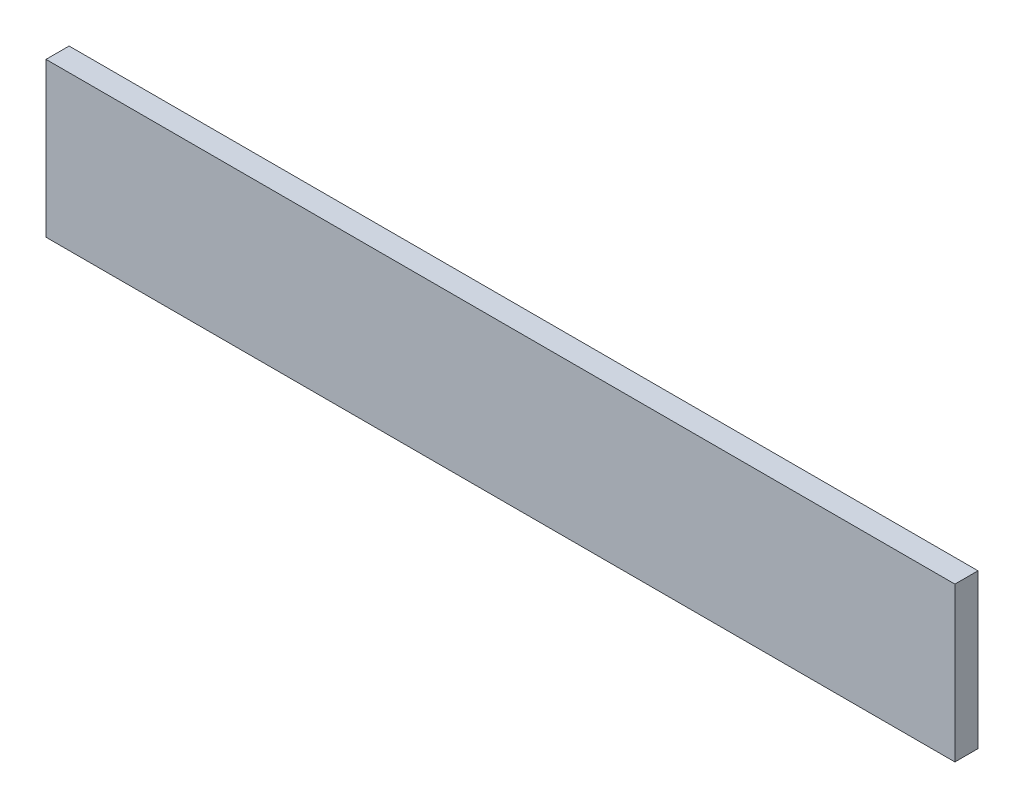
from build123d import *

# Parameters (mm, degrees)
SKETCH1_W           = 19.05
SKETCH1_H           = 127
BOSS_EXTRUDE1_DEPTH = 749.3


with BuildPart() as part:
    # Sketch1 → Boss-Extrude1 (new body)
    with BuildSketch(Plane(origin=(0, 0, 0), x_dir=(0, 0, -1), z_dir=(1, 0, 0))):
        with Locations((1.632857143, -26.624642857)):
            Rectangle(SKETCH1_W, SKETCH1_H)
    extrude(amount=BOSS_EXTRUDE1_DEPTH)


solid = part.part
